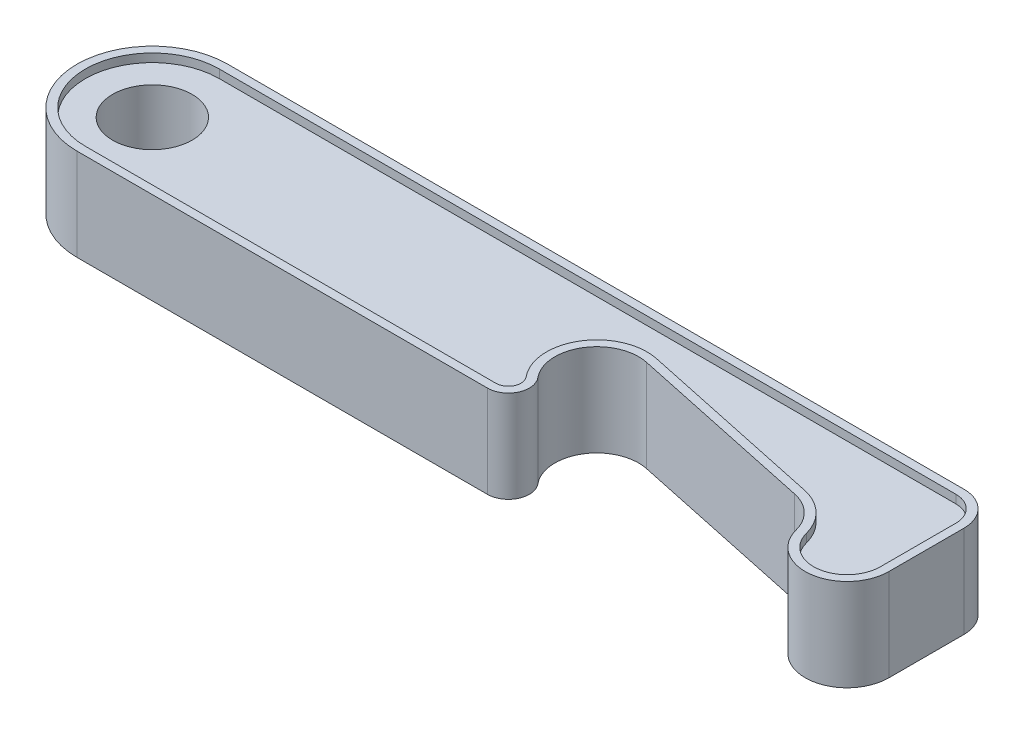
from build123d import *

# Parameters (mm, degrees)
BOSS_EXTRUDE1_DEPTH      = 4.5
BOSS_EXTRUDE1_DEPTH_BACK = 4.5
SKETCH1_R                = 4.75
BOSS_EXTRUDE2_DEPTH      = 5.5
BOSS_EXTRUDE2_DEPTH_BACK = 5.5


with BuildPart() as part:
    # Sketch1 → Boss-Extrude1 (new, two sides: drawn at the far end of the back side and taken through both)
    with BuildSketch(Plane(origin=(0, 0, 0), x_dir=(1, 0, 0), z_dir=(0, 1, 0)).offset(-BOSS_EXTRUDE1_DEPTH_BACK)):
        with BuildLine():
            ThreePointArc((0, 8), (-8, 0), (0, -8))
            Line((0, -8), (49.040217235, -8))
            ThreePointArc((49.040217235, -8), (50.397559636, -7.138452508), (50.195682115, -5.543495472))
            ThreePointArc((50.195682115, -5.543495472), (49.68486052, 1.389866291), (56.065011779, 4.151408242))
            Line((56.065011779, 4.151408242), (78.565011779, -0.631114396))
            ThreePointArc((78.565011779, -0.631114396), (81.467470443, -2.166630539), (83.127016654, -5))
            ThreePointArc((83.127016654, -5), (87.50401717, -7.968118785), (91, -4))
            Line((91, -4), (91, 5))
            ThreePointArc((91, 5), (90.121320344, 7.121320344), (88, 8))
            Line((88, 8), (0, 8))
        make_face()
        Circle(SKETCH1_R, mode=Mode.SUBTRACT)
    extrude(amount=BOSS_EXTRUDE1_DEPTH + BOSS_EXTRUDE1_DEPTH_BACK)

    # Sketch1<3> → Boss-Extrude2 (add, two sides: drawn at the far end of the back side and taken through both)
    with BuildSketch(Plane(origin=(0, 0, 0), x_dir=(1, 0, 0), z_dir=(0, 1, 0)).offset(-BOSS_EXTRUDE2_DEPTH_BACK)):
        with BuildLine():
            ThreePointArc((0, 9), (-9, 0), (0, -9))
            Line((0, -9), (49.040217235, -9))
            ThreePointArc((49.040217235, -9), (51.302454571, -7.564087513), (50.965992035, -4.905825787))
            ThreePointArc((50.965992035, -4.905825787), (50.540307373, 0.871975682), (55.857100089, 3.173260641))
            Line((55.857100089, 3.173260641), (78.357100089, -1.609261996))
            ThreePointArc((78.357100089, -1.609261996), (80.775815642, -2.888858783), (82.158770817, -5.25))
            ThreePointArc((82.158770817, -5.25), (87.630021462, -8.960148481), (92, -4))
            Line((92, -4), (92, 5))
            ThreePointArc((92, 5), (90.828427125, 7.828427125), (88, 9))
            Line((88, 9), (0, 9))
        make_face()
        with BuildLine():
            Line((91, 5), (91, -4))
            ThreePointArc((91, -4), (87.50401717, -7.968118785), (83.127016654, -5))
            ThreePointArc((83.127016654, -5), (81.467470443, -2.166630539), (78.565011779, -0.631114396))
            Line((78.565011779, -0.631114396), (56.065011779, 4.151408242))
            ThreePointArc((56.065011779, 4.151408242), (49.68486052, 1.389866291), (50.195682115, -5.543495472))
            ThreePointArc((50.195682115, -5.543495472), (50.397559636, -7.138452508), (49.040217235, -8))
            Line((49.040217235, -8), (0, -8))
            ThreePointArc((0, -8), (-8, 0), (0, 8))
            Line((0, 8), (88, 8))
            ThreePointArc((88, 8), (90.121320344, 7.121320344), (91, 5))
        make_face(mode=Mode.SUBTRACT)
    extrude(amount=BOSS_EXTRUDE2_DEPTH + BOSS_EXTRUDE2_DEPTH_BACK)


solid = part.part
